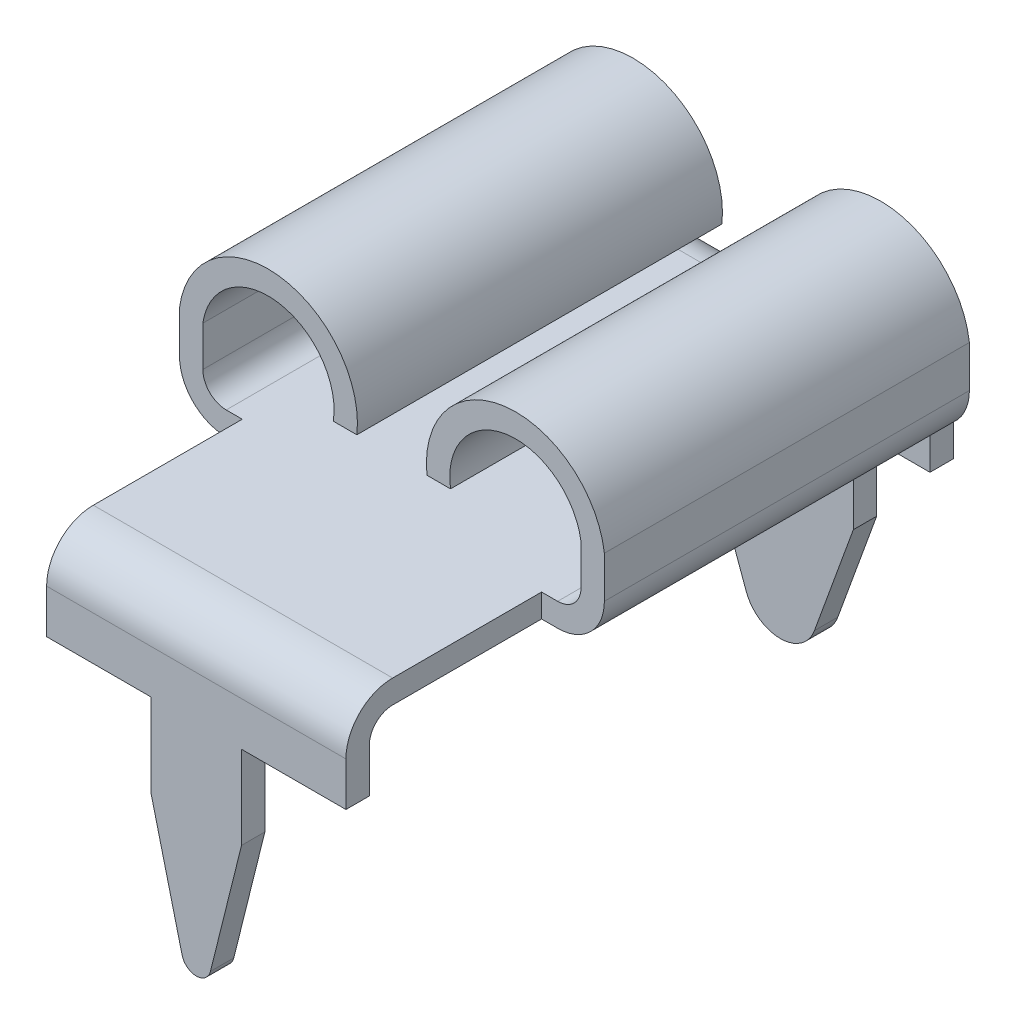
from build123d import *

# Parameters (mm, degrees)
BOSS_EXTRUDE1_DEPTH = 5.207
CUT_EXTRUDE1_DEPTH  = 5.207
CUT_EXTRUDE2_DEPTH  = 5.207
FILLET1_R           = 0.4064
FILLET2_R           = 0.8128
BOSS_EXTRUDE2_DEPTH = 6.35


with BuildPart() as part:
    # Sketch1 → Boss-Extrude1 (new body)
    with BuildSketch(Plane(origin=(0, 0, 0), x_dir=(0, 0, -1), z_dir=(1, 0, 0))):
        Polygon((-0.2032, 0), (-0.2032, 5.3848), (10.3632, 5.3848), (10.3632, 0), (9.9568, 0), (9.9568, 4.9784), (0.2032, 4.9784), (0.2032, 0), align=None)
    extrude(amount=BOSS_EXTRUDE1_DEPTH)

    # Sketch2 → Cut-Extrude1 (cut)
    with BuildSketch(Plane(origin=(0, 0, -10.3632), x_dir=(-1, 0, 0), z_dir=(0, 0, -1))):
        with BuildLine():
            Line((-1.3335, 2.278639677), (-1.3335, 3.81))
            Line((-1.3335, 3.81), (0, 3.81))
            Line((0, 3.81), (0, -0.271412918))
            Line((0, -0.271412918), (-5.207, -0.271412918))
            Line((-5.207, -0.271412918), (-5.207, 3.81))
            Line((-5.207, 3.81), (-3.8735, 3.81))
            Line((-3.8735, 3.81), (-3.8735, 2.278639677))
            Line((-3.8735, 2.278639677), (-3.196682612, 0.419099186))
            ThreePointArc((-3.196682612, 0.419099186), (-2.6035, 0.003748249), (-2.010317388, 0.419099186))
            Line((-2.010317388, 0.419099186), (-1.3335, 2.278639677))
        make_face()
    extrude(amount=-CUT_EXTRUDE1_DEPTH, mode=Mode.SUBTRACT)

    # Sketch4 → Cut-Extrude2 (cut)
    with BuildSketch(Plane.XY.offset(0.2032)):
        with BuildLine():
            Line((0, 3.81), (0, -0.293581738))
            Line((0, -0.293581738), (5.207, -0.293581738))
            Line((5.207, -0.293581738), (5.207, 3.81))
            Line((5.207, 3.81), (3.3909, 3.81))
            Line((3.3909, 3.81), (3.3909, 2.362163271))
            Line((3.3909, 2.362163271), (2.849955114, 0.192551839))
            ThreePointArc((2.849955114, 0.192551839), (2.6035, 0), (2.357044886, 0.192551839))
            Line((2.357044886, 0.192551839), (1.8161, 2.362163271))
            Line((1.8161, 2.362163271), (1.8161, 3.81))
            Line((1.8161, 3.81), (0, 3.81))
        make_face()
    extrude(amount=-CUT_EXTRUDE2_DEPTH, mode=Mode.SUBTRACT)

    # Fillet1
    fillet1_edges = [part.edges().sort_by_distance(p)[0] for p in [
        (2.6035, 4.9784, -9.9568),
        (2.6035, 4.9784, -0.2032),
    ]]
    fillet(fillet1_edges, radius=FILLET1_R)

    # Fillet2
    fillet2_edges = [part.edges().sort_by_distance(p)[0] for p in [
        (2.6035, 5.3848, 0.2032),
        (2.6035, 5.3848, -10.3632),
    ]]
    fillet(fillet2_edges, radius=FILLET2_R)

    # Sketch5 → Boss-Extrude2 (add)
    with BuildSketch(Plane(origin=(0, 0, -9.5504), x_dir=(-1, 0, 0), z_dir=(0, 0, -1))):
        with BuildLine():
            Line((1.0922, 5.7912), (1.0922, 6.515909549))
            ThreePointArc((1.0922, 6.515909549), (-0.634040977, 7.863002154), (-1.9939, 6.1468))
            Line((-1.9939, 6.1468), (-1.584040966, 6.1468))
            ThreePointArc((-1.584040966, 6.1468), (-0.620193607, 7.454832725), (0.6858, 6.488224201))
            Line((0.6858, 6.488224201), (0.6858, 5.7912))
            ThreePointArc((0.6858, 5.7912), (0.566768196, 5.503831804), (0.2794, 5.3848))
            Line((0.2794, 5.3848), (0, 5.3848))
            Line((0, 5.3848), (0, 4.9784))
            Line((0, 4.9784), (0.2794, 4.9784))
            ThreePointArc((0.2794, 4.9784), (0.854136392, 5.216463608), (1.0922, 5.7912))
        make_face()
        with BuildLine():
            Line((-5.207, 4.9784), (-5.207, 5.3848))
            Line((-5.207, 5.3848), (-5.4864, 5.3848))
            ThreePointArc((-5.4864, 5.3848), (-5.773768196, 5.503831804), (-5.8928, 5.7912))
            Line((-5.8928, 5.7912), (-5.8928, 6.488224201))
            ThreePointArc((-5.8928, 6.488224201), (-4.586806393, 7.454832725), (-3.622959034, 6.1468))
            Line((-3.622959034, 6.1468), (-3.2131, 6.1468))
            ThreePointArc((-3.2131, 6.1468), (-4.572959023, 7.863002154), (-6.2992, 6.515909549))
            Line((-6.2992, 6.515909549), (-6.2992, 5.7912))
            ThreePointArc((-6.2992, 5.7912), (-6.061136392, 5.216463608), (-5.4864, 4.9784))
            Line((-5.4864, 4.9784), (-5.207, 4.9784))
        make_face()
    extrude(amount=-BOSS_EXTRUDE2_DEPTH)


solid = part.part
